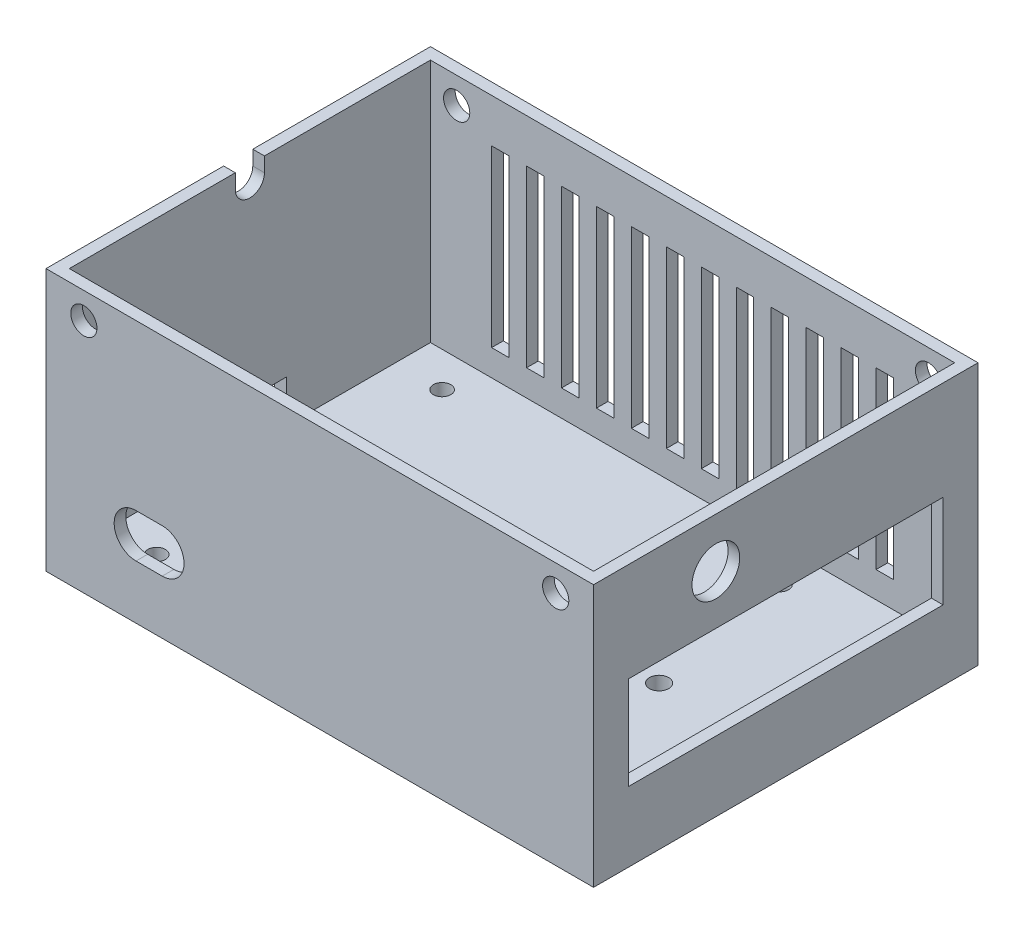
from build123d import *

# Parameters (mm, degrees)
SKETCH1_W           = 90
SKETCH1_H           = 62
BOSS_EXTRUDE1_DEPTH = 3
CUT_EXTRUDE1_REACH  = 56.727
SKETCH2_R           = 1.5
SKETCH3_W           = 94
SKETCH3_H           = 66
SKETCH3_W_2         = 90
SKETCH3_H_2         = 62
BOSS_EXTRUDE2_DEPTH = 45
CUT_EXTRUDE2_REACH  = 109.601
SKETCH4_W           = 12.5
SKETCH4_H           = 2.5
CUT_EXTRUDE3_REACH  = 93.269
CUT_EXTRUDE4_REACH  = 109.601
SKETCH6_W           = 54
SKETCH6_H           = 16
CUT_EXTRUDE5_REACH  = 111.316
SKETCH7_R           = 4.1
SKETCH8_R           = 2.25
CUT_EXTRUDE6_DEPTH  = 93.682252886
CUT_EXTRUDE7_DEPTH  = 72.147733625
CUT_EXTRUDE8_REACH  = 94.682
SKETCH10_W          = 3
SKETCH10_H          = 30
CUT_EXTRUDE9_REACH  = 111.316


with BuildPart() as part:
    # Sketch1 → Boss-Extrude1 (new body)
    with BuildSketch(Plane(origin=(0, 0, 0), x_dir=(1, 0, 0), z_dir=(0, 1, 0))):
        Rectangle(SKETCH1_W, SKETCH1_H)
    extrude(amount=BOSS_EXTRUDE1_DEPTH)

    # Sketch2 → Cut-Extrude1 (cut, up to next)
    with BuildSketch(Plane(origin=(0, 3, 0), x_dir=(1, 0, 0), z_dir=(0, 1, 0)), mode=Mode.PRIVATE) as cut_extrude1_sk1:
        with Locations(Location((-37, -24, 0), (0, 0, 270))):
            Circle(SKETCH2_R)
    cut_extrude1_tool1 = extrude(cut_extrude1_sk1.sketch, amount=-CUT_EXTRUDE1_REACH, mode=Mode.PRIVATE) & part.part
    # Sketch2 → Cut-Extrude1 (cut, up to next)
    with BuildSketch(Plane(origin=(0, 3, 0), x_dir=(1, 0, 0), z_dir=(0, 1, 0)), mode=Mode.PRIVATE) as cut_extrude1_sk2:
        with Locations(Location((21, -24, 0), (0, 0, 270))):
            Circle(SKETCH2_R)
    cut_extrude1_tool2 = extrude(cut_extrude1_sk2.sketch, amount=-CUT_EXTRUDE1_REACH, mode=Mode.PRIVATE) & part.part
    # Sketch2 → Cut-Extrude1 (cut, up to next)
    with BuildSketch(Plane(origin=(0, 3, 0), x_dir=(1, 0, 0), z_dir=(0, 1, 0)), mode=Mode.PRIVATE) as cut_extrude1_sk3:
        with Locations(Location((21, 25, 0), (0, 0, 270))):
            Circle(SKETCH2_R)
    cut_extrude1_tool3 = extrude(cut_extrude1_sk3.sketch, amount=-CUT_EXTRUDE1_REACH, mode=Mode.PRIVATE) & part.part
    # Sketch2 → Cut-Extrude1 (cut, up to next)
    with BuildSketch(Plane(origin=(0, 3, 0), x_dir=(1, 0, 0), z_dir=(0, 1, 0)), mode=Mode.PRIVATE) as cut_extrude1_sk4:
        with Locations(Location((-37, 25, 0), (0, 0, 270))):
            Circle(SKETCH2_R)
    cut_extrude1_tool4 = extrude(cut_extrude1_sk4.sketch, amount=-CUT_EXTRUDE1_REACH, mode=Mode.PRIVATE) & part.part
    add(cut_extrude1_tool1.solids().sort_by_distance((-37, 3, 24))[0], mode=Mode.SUBTRACT)
    add(cut_extrude1_tool2.solids().sort_by_distance((21, 3, 24))[0], mode=Mode.SUBTRACT)
    add(cut_extrude1_tool3.solids().sort_by_distance((21, 3, -25))[0], mode=Mode.SUBTRACT)
    add(cut_extrude1_tool4.solids().sort_by_distance((-37, 3, -25))[0], mode=Mode.SUBTRACT)

    # Sketch3 → Boss-Extrude2 (add)
    with BuildSketch(Plane(origin=(0, 0, 0), x_dir=(1, 0, 0), z_dir=(0, 1, 0))):
        Rectangle(SKETCH3_W, SKETCH3_H)
        Rectangle(SKETCH3_W_2, SKETCH3_H_2, mode=Mode.SUBTRACT)
    extrude(amount=BOSS_EXTRUDE2_DEPTH)

    # Sketch4 → Cut-Extrude2 (cut, up to next)
    with BuildSketch(Plane(origin=(-45, 0, 0), x_dir=(0, 0, -1), z_dir=(1, 0, 0)), mode=Mode.PRIVATE) as cut_extrude2_sk1:
        with Locations((0, 9)):
            Rectangle(SKETCH4_W, SKETCH4_H)
    cut_extrude2_tool1 = extrude(cut_extrude2_sk1.sketch, amount=-CUT_EXTRUDE2_REACH, mode=Mode.PRIVATE) & part.part
    add(cut_extrude2_tool1.solids().sort_by_distance((-45, 9, 0))[0], mode=Mode.SUBTRACT)

    # Sketch5 → Cut-Extrude3 (cut, up to next)
    with BuildSketch(Plane(origin=(0, 0, 31), x_dir=(-1, 0, 0), z_dir=(0, 0, -1)), mode=Mode.PRIVATE) as cut_extrude3_sk1:
        with BuildLine():
            Line((31.55, 9.25), (27.05, 9.25))
            ThreePointArc((27.05, 9.25), (23.3, 13), (27.05, 16.75))
            Line((27.05, 16.75), (31.55, 16.75))
            ThreePointArc((31.55, 16.75), (35.3, 13), (31.55, 9.25))
        make_face()
    cut_extrude3_tool1 = extrude(cut_extrude3_sk1.sketch, amount=-CUT_EXTRUDE3_REACH, mode=Mode.PRIVATE) & part.part
    add(cut_extrude3_tool1.solids().sort_by_distance((-29.3, 13, 31))[0], mode=Mode.SUBTRACT)

    # Sketch6 → Cut-Extrude4 (cut, up to next)
    with BuildSketch(Plane.ZY.offset(-45), mode=Mode.PRIVATE) as cut_extrude4_sk1:
        with Locations((0, 20)):
            Rectangle(SKETCH6_W, SKETCH6_H)
    cut_extrude4_tool1 = extrude(cut_extrude4_sk1.sketch, amount=-CUT_EXTRUDE4_REACH, mode=Mode.PRIVATE) & part.part
    add(cut_extrude4_tool1.solids().sort_by_distance((45, 20, 0))[0], mode=Mode.SUBTRACT)

    # Sketch7 → Cut-Extrude5 (cut, up to next)
    with BuildSketch(Plane(origin=(47, 0, 0), x_dir=(0, 0, -1), z_dir=(1, 0, 0)), mode=Mode.PRIVATE) as cut_extrude5_sk1:
        with Locations((-12, 36.5)):
            Circle(SKETCH7_R)
    cut_extrude5_tool1 = extrude(cut_extrude5_sk1.sketch, amount=-CUT_EXTRUDE5_REACH, mode=Mode.PRIVATE) & part.part
    add(cut_extrude5_tool1.solids().sort_by_distance((47, 36.5, 12))[0], mode=Mode.SUBTRACT)

    # Sketch8 → Cut-Extrude6 (cut, through all)
    with BuildSketch(Plane.XY.offset(33)):
        with Locations((-40.5, 40.5)):
            Circle(SKETCH8_R)
        with Locations(Location((40.5, 40.5, 0), (0, 0, 180))):
            Circle(SKETCH8_R)
    extrude(amount=-CUT_EXTRUDE6_DEPTH, mode=Mode.SUBTRACT)

    # Sketch9 → Cut-Extrude7 (cut, through all)
    with BuildSketch(Plane(origin=(0, 3, 0), x_dir=(1, 0, 0), z_dir=(0, 1, 0))):
        with BuildLine():
            ThreePointArc((-23.6, 0), (-25.25, 1.65), (-26.9, 0))
            Line((-26.9, 0), (-23.6, 0))
        make_face()
        with BuildLine():
            Line((-23.6, 0), (-26.9, 0))
            ThreePointArc((-26.9, 0), (-25.25, -1.65), (-23.6, 0))
        make_face()
        with BuildLine():
            ThreePointArc((1.65, 0), (0, 1.65), (-1.65, 0))
            Line((-1.65, 0), (1.65, 0))
        make_face()
        with BuildLine():
            Line((1.65, 0), (-1.65, 0))
            ThreePointArc((-1.65, 0), (0, -1.65), (1.65, 0))
        make_face()
        with BuildLine():
            ThreePointArc((26.9, 0), (25.25, 1.65), (23.6, 0))
            Line((23.6, 0), (26.9, 0))
        make_face()
        with BuildLine():
            Line((26.9, 0), (23.6, 0))
            ThreePointArc((23.6, 0), (25.25, -1.65), (26.9, 0))
        make_face()
    extrude(amount=-CUT_EXTRUDE7_DEPTH, mode=Mode.SUBTRACT)

    # Sketch10 → Cut-Extrude8 (cut, up to next)
    with BuildSketch(Plane(origin=(0, 0, -33), x_dir=(-1, 0, 0), z_dir=(0, 0, -1)), mode=Mode.PRIVATE) as cut_extrude8_sk1:
        with Locations((9, 22.5)):
            Rectangle(SKETCH10_W, SKETCH10_H)
    cut_extrude8_tool1 = extrude(cut_extrude8_sk1.sketch, amount=-CUT_EXTRUDE8_REACH, mode=Mode.PRIVATE) & part.part
    # Sketch10 → Cut-Extrude8 (cut, up to next)
    with BuildSketch(Plane(origin=(0, 0, -33), x_dir=(-1, 0, 0), z_dir=(0, 0, -1)), mode=Mode.PRIVATE) as cut_extrude8_sk2:
        with Locations((3, 22.5)):
            Rectangle(SKETCH10_W, SKETCH10_H)
    cut_extrude8_tool2 = extrude(cut_extrude8_sk2.sketch, amount=-CUT_EXTRUDE8_REACH, mode=Mode.PRIVATE) & part.part
    # Sketch10 → Cut-Extrude8 (cut, up to next)
    with BuildSketch(Plane(origin=(0, 0, -33), x_dir=(-1, 0, 0), z_dir=(0, 0, -1)), mode=Mode.PRIVATE) as cut_extrude8_sk3:
        with Locations((15, 22.5)):
            Rectangle(SKETCH10_W, SKETCH10_H)
    cut_extrude8_tool3 = extrude(cut_extrude8_sk3.sketch, amount=-CUT_EXTRUDE8_REACH, mode=Mode.PRIVATE) & part.part
    # Sketch10 → Cut-Extrude8 (cut, up to next)
    with BuildSketch(Plane(origin=(0, 0, -33), x_dir=(-1, 0, 0), z_dir=(0, 0, -1)), mode=Mode.PRIVATE) as cut_extrude8_sk4:
        with Locations((21, 22.5)):
            Rectangle(SKETCH10_W, SKETCH10_H)
    cut_extrude8_tool4 = extrude(cut_extrude8_sk4.sketch, amount=-CUT_EXTRUDE8_REACH, mode=Mode.PRIVATE) & part.part
    # Sketch10 → Cut-Extrude8 (cut, up to next)
    with BuildSketch(Plane(origin=(0, 0, -33), x_dir=(-1, 0, 0), z_dir=(0, 0, -1)), mode=Mode.PRIVATE) as cut_extrude8_sk5:
        with Locations((27, 22.5)):
            Rectangle(SKETCH10_W, SKETCH10_H)
    cut_extrude8_tool5 = extrude(cut_extrude8_sk5.sketch, amount=-CUT_EXTRUDE8_REACH, mode=Mode.PRIVATE) & part.part
    # Sketch10 → Cut-Extrude8 (cut, up to next)
    with BuildSketch(Plane(origin=(0, 0, -33), x_dir=(-1, 0, 0), z_dir=(0, 0, -1)), mode=Mode.PRIVATE) as cut_extrude8_sk6:
        with Locations((33, 22.5)):
            Rectangle(SKETCH10_W, SKETCH10_H)
    cut_extrude8_tool6 = extrude(cut_extrude8_sk6.sketch, amount=-CUT_EXTRUDE8_REACH, mode=Mode.PRIVATE) & part.part
    # Sketch10 → Cut-Extrude8 (cut, up to next)
    with BuildSketch(Plane(origin=(0, 0, -33), x_dir=(-1, 0, 0), z_dir=(0, 0, -1)), mode=Mode.PRIVATE) as cut_extrude8_sk7:
        with Locations((-3, 22.5)):
            Rectangle(SKETCH10_W, SKETCH10_H)
    cut_extrude8_tool7 = extrude(cut_extrude8_sk7.sketch, amount=-CUT_EXTRUDE8_REACH, mode=Mode.PRIVATE) & part.part
    # Sketch10 → Cut-Extrude8 (cut, up to next)
    with BuildSketch(Plane(origin=(0, 0, -33), x_dir=(-1, 0, 0), z_dir=(0, 0, -1)), mode=Mode.PRIVATE) as cut_extrude8_sk8:
        with Locations((-9, 22.5)):
            Rectangle(SKETCH10_W, SKETCH10_H)
    cut_extrude8_tool8 = extrude(cut_extrude8_sk8.sketch, amount=-CUT_EXTRUDE8_REACH, mode=Mode.PRIVATE) & part.part
    # Sketch10 → Cut-Extrude8 (cut, up to next)
    with BuildSketch(Plane(origin=(0, 0, -33), x_dir=(-1, 0, 0), z_dir=(0, 0, -1)), mode=Mode.PRIVATE) as cut_extrude8_sk9:
        with Locations((-15, 22.5)):
            Rectangle(SKETCH10_W, SKETCH10_H)
    cut_extrude8_tool9 = extrude(cut_extrude8_sk9.sketch, amount=-CUT_EXTRUDE8_REACH, mode=Mode.PRIVATE) & part.part
    # Sketch10 → Cut-Extrude8 (cut, up to next)
    with BuildSketch(Plane(origin=(0, 0, -33), x_dir=(-1, 0, 0), z_dir=(0, 0, -1)), mode=Mode.PRIVATE) as cut_extrude8_sk10:
        with Locations((-21, 22.5)):
            Rectangle(SKETCH10_W, SKETCH10_H)
    cut_extrude8_tool10 = extrude(cut_extrude8_sk10.sketch, amount=-CUT_EXTRUDE8_REACH, mode=Mode.PRIVATE) & part.part
    # Sketch10 → Cut-Extrude8 (cut, up to next)
    with BuildSketch(Plane(origin=(0, 0, -33), x_dir=(-1, 0, 0), z_dir=(0, 0, -1)), mode=Mode.PRIVATE) as cut_extrude8_sk11:
        with Locations((-27, 22.5)):
            Rectangle(SKETCH10_W, SKETCH10_H)
    cut_extrude8_tool11 = extrude(cut_extrude8_sk11.sketch, amount=-CUT_EXTRUDE8_REACH, mode=Mode.PRIVATE) & part.part
    # Sketch10 → Cut-Extrude8 (cut, up to next)
    with BuildSketch(Plane(origin=(0, 0, -33), x_dir=(-1, 0, 0), z_dir=(0, 0, -1)), mode=Mode.PRIVATE) as cut_extrude8_sk12:
        with Locations((-33, 22.5)):
            Rectangle(SKETCH10_W, SKETCH10_H)
    cut_extrude8_tool12 = extrude(cut_extrude8_sk12.sketch, amount=-CUT_EXTRUDE8_REACH, mode=Mode.PRIVATE) & part.part
    add(cut_extrude8_tool1.solids().sort_by_distance((-9, 22.5, -33))[0], mode=Mode.SUBTRACT)
    add(cut_extrude8_tool2.solids().sort_by_distance((-3, 22.5, -33))[0], mode=Mode.SUBTRACT)
    add(cut_extrude8_tool3.solids().sort_by_distance((-15, 22.5, -33))[0], mode=Mode.SUBTRACT)
    add(cut_extrude8_tool4.solids().sort_by_distance((-21, 22.5, -33))[0], mode=Mode.SUBTRACT)
    add(cut_extrude8_tool5.solids().sort_by_distance((-27, 22.5, -33))[0], mode=Mode.SUBTRACT)
    add(cut_extrude8_tool6.solids().sort_by_distance((-33, 22.5, -33))[0], mode=Mode.SUBTRACT)
    add(cut_extrude8_tool7.solids().sort_by_distance((3, 22.5, -33))[0], mode=Mode.SUBTRACT)
    add(cut_extrude8_tool8.solids().sort_by_distance((9, 22.5, -33))[0], mode=Mode.SUBTRACT)
    add(cut_extrude8_tool9.solids().sort_by_distance((15, 22.5, -33))[0], mode=Mode.SUBTRACT)
    add(cut_extrude8_tool10.solids().sort_by_distance((21, 22.5, -33))[0], mode=Mode.SUBTRACT)
    add(cut_extrude8_tool11.solids().sort_by_distance((27, 22.5, -33))[0], mode=Mode.SUBTRACT)
    add(cut_extrude8_tool12.solids().sort_by_distance((33, 22.5, -33))[0], mode=Mode.SUBTRACT)

    # Sketch11 → Cut-Extrude9 (cut, up to next)
    with BuildSketch(Plane.ZY.offset(47), mode=Mode.PRIVATE) as cut_extrude9_sk1:
        with BuildLine():
            Line((2.5, 47.5), (2.5, 42.5))
            ThreePointArc((2.5, 42.5), (0, 40), (-2.5, 42.5))
            Line((-2.5, 42.5), (-2.5, 47.5))
            ThreePointArc((-2.5, 47.5), (0, 50), (2.5, 47.5))
        make_face()
    cut_extrude9_tool1 = extrude(cut_extrude9_sk1.sketch, amount=-CUT_EXTRUDE9_REACH, mode=Mode.PRIVATE) & part.part
    add(cut_extrude9_tool1.solids().sort_by_distance((-47, 45, 0))[0], mode=Mode.SUBTRACT)


solid = part.part
